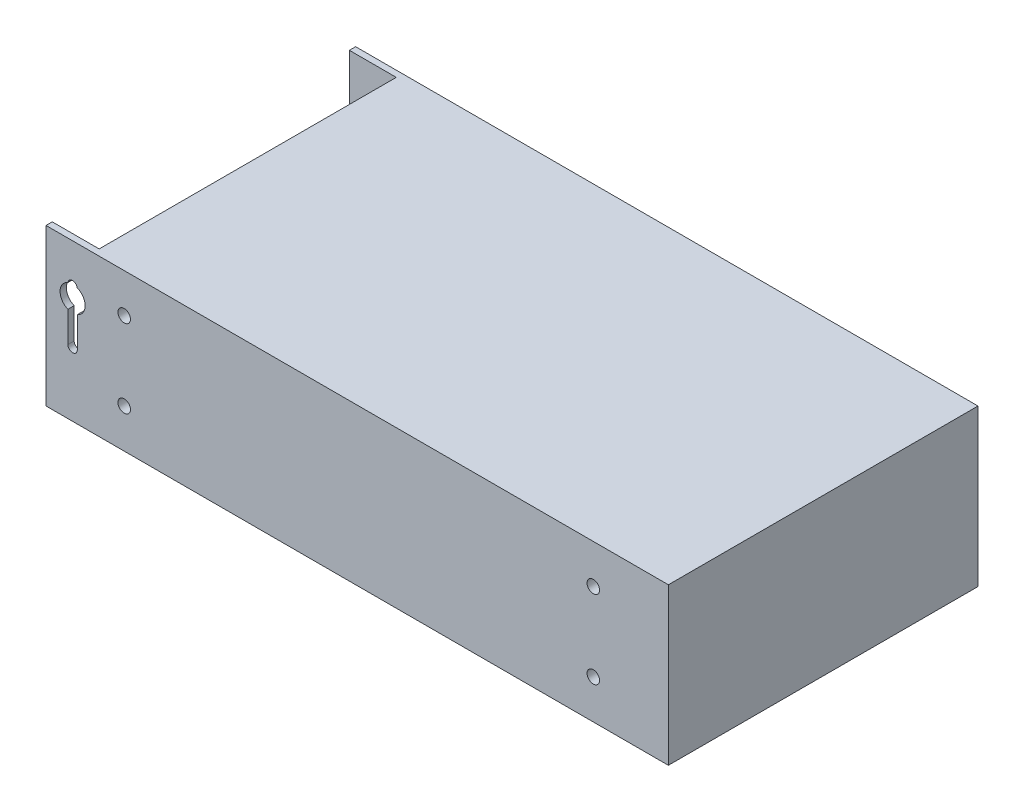
from build123d import *

# Parameters (mm, degrees)
SKETCH_1_W          = 199
SKETCH_1_H          = 99
EXTRUDE_1_DEPTH     = 9
SKETCH_2_W          = 199
SKETCH_2_H          = 2
EXTRUDE_2_DEPTH     = 41
SKETCH_4_W          = 199
SKETCH_4_H          = 2
EXTRUDE_3_DEPTH     = 41
SKETCH_5_W          = 184
SKETCH_5_H          = 95
EXTRUDE_4_DEPTH     = 41
SKETCH_6_R          = 2
CUT_EXTRUDE_2_DEPTH = 10
CUT_EXTRUDE_3_DEPTH = 10
SKETCH_10_R         = 2
CUT_EXTRUDE_4_DEPTH = 158.091394395
SKETCH_11_R         = 1.5
CUT_EXTRUDE_5_DEPTH = 6


with BuildPart() as part:
    # 草图1 → 凸台-拉伸1 (new body)
    with BuildSketch(Plane(origin=(0, 0, 0), x_dir=(1, 0, 0), z_dir=(0, 1, 0))):
        with Locations((11.750645809, -1.511939619)):
            Rectangle(SKETCH_1_W, SKETCH_1_H)
    extrude(amount=EXTRUDE_1_DEPTH)

    # 草图2 → 凸台-拉伸2 (add)
    with BuildSketch(Plane(origin=(0, 9, 0), x_dir=(1, 0, 0), z_dir=(0, 1, 0))):
        with Locations((11.750645809, -50.011939619)):
            Rectangle(SKETCH_2_W, SKETCH_2_H)
    extrude(amount=EXTRUDE_2_DEPTH)

    # 草图4 → 凸台-拉伸3 (add)
    with BuildSketch(Plane(origin=(0, 9, 0), x_dir=(1, 0, 0), z_dir=(0, 1, 0))):
        with Locations((11.750645809, 46.988060381)):
            Rectangle(SKETCH_4_W, SKETCH_4_H)
    extrude(amount=EXTRUDE_3_DEPTH)

    # 草图5 → 凸台-拉伸4 (add)
    with BuildSketch(Plane(origin=(0, 9, 0), x_dir=(1, 0, 0), z_dir=(0, 1, 0))):
        with Locations((19.250645809, -1.511939619)):
            Rectangle(SKETCH_5_W, SKETCH_5_H)
    extrude(amount=EXTRUDE_4_DEPTH)

    # 草图6 → 切除-拉伸2 (cut)
    with BuildSketch(Plane.XY.offset(51.011939619)):
        with Locations((87.250645809, 37.5)):
            Circle(SKETCH_6_R)
        with Locations((87.250645809, 12.5)):
            Circle(SKETCH_6_R)
        with Locations((-62.749354191, 12.5)):
            Circle(SKETCH_6_R)
        with Locations((-62.749354191, 37.5)):
            Circle(SKETCH_6_R)
    extrude(amount=-CUT_EXTRUDE_2_DEPTH, mode=Mode.SUBTRACT)

    # 草图8 → 切除-拉伸3 (cut)
    with BuildSketch(Plane.XY.offset(51.011939619)):
        with BuildLine():
            ThreePointArc((-77.764739213, 37.714285714), (-79.249354191, 39), (-80.733969169, 37.714285714))
            ThreePointArc((-80.733969169, 37.714285714), (-83.249345598, 34.00829113), (-80.749354191, 30.291900756))
            Line((-80.749354191, 30.291900756), (-80.749354191, 20.5))
            ThreePointArc((-80.749354191, 20.5), (-79.249354191, 19), (-77.749354191, 20.5))
            Line((-77.749354191, 20.5), (-77.749354191, 30.291900756))
            ThreePointArc((-77.749354191, 30.291900756), (-75.249362784, 34.00829113), (-77.764739213, 37.714285714))
        make_face()
    extrude(amount=-CUT_EXTRUDE_3_DEPTH, mode=Mode.SUBTRACT)

    # 草图10 → 切除-拉伸4 (cut, through all)
    with BuildSketch(Plane(origin=(0, 0, -47.988060381), x_dir=(-1, 0, 0), z_dir=(0, 0, -1))):
        with Locations(Location((62.749354191, 12.5, 0), (0, 0, 180))):
            Circle(SKETCH_10_R)
        with Locations(Location((-87.250645809, 12.5, 0), (0, 0, 180))):
            Circle(SKETCH_10_R)
    extrude(amount=-CUT_EXTRUDE_4_DEPTH, mode=Mode.SUBTRACT)

    # 草图11 → 切除-拉伸5 (cut)
    with BuildSketch(Plane(origin=(0, 0, 0), x_dir=(-1, 0, 0), z_dir=(0, -1, 0))):
        with Locations(Location((72.749354191, 23.488060381, 0), (0, 0, 90))):
            Circle(SKETCH_11_R)
        with Locations(Location((72.749354191, -26.511939619, 0), (0, 0, 90))):
            Circle(SKETCH_11_R)
        with Locations(Location((-77.250645809, 23.488060381, 0), (0, 0, 90))):
            Circle(SKETCH_11_R)
        with Locations(Location((-77.250645809, -26.511939619, 0), (0, 0, 90))):
            Circle(SKETCH_11_R)
    extrude(amount=-CUT_EXTRUDE_5_DEPTH, mode=Mode.SUBTRACT)


solid = part.part
